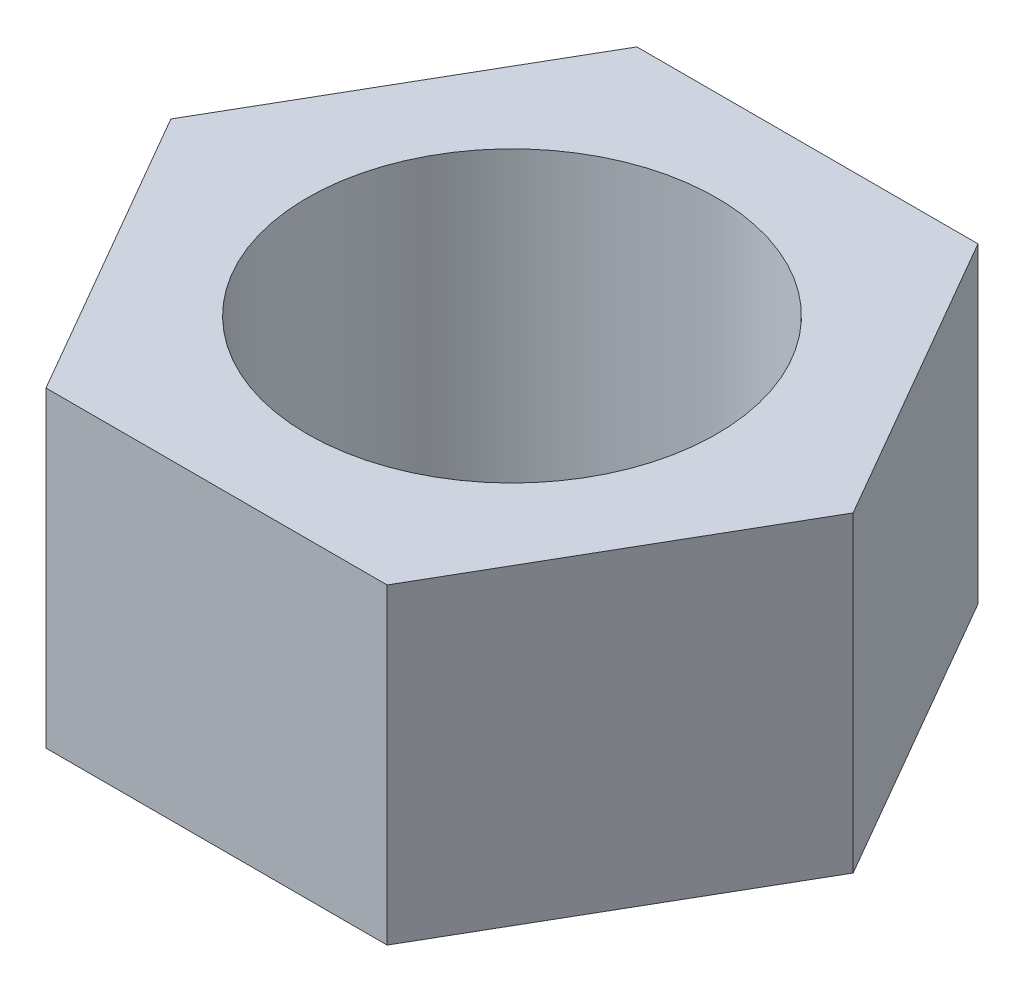
from build123d import *

# Parameters (mm, degrees)
SKETCH1_R           = 2100
BOSS_EXTRUDE1_DEPTH = 3200


with BuildPart() as part:
    # Sketch1 → Boss-Extrude1 (new body)
    with BuildSketch(Plane(origin=(0, 0, 0), x_dir=(1, 0, 0), z_dir=(0, 1, 0))):
        Polygon((3500, 0), (1750, 3031.088913246), (-1750, 3031.088913246), (-3500, 0), (-1750, -3031.088913246), (1750, -3031.088913246), align=None)
        with Locations(Location((0, 0, 0), (0, 0, 270))):
            Circle(SKETCH1_R, mode=Mode.SUBTRACT)
    extrude(amount=BOSS_EXTRUDE1_DEPTH)


solid = part.part
